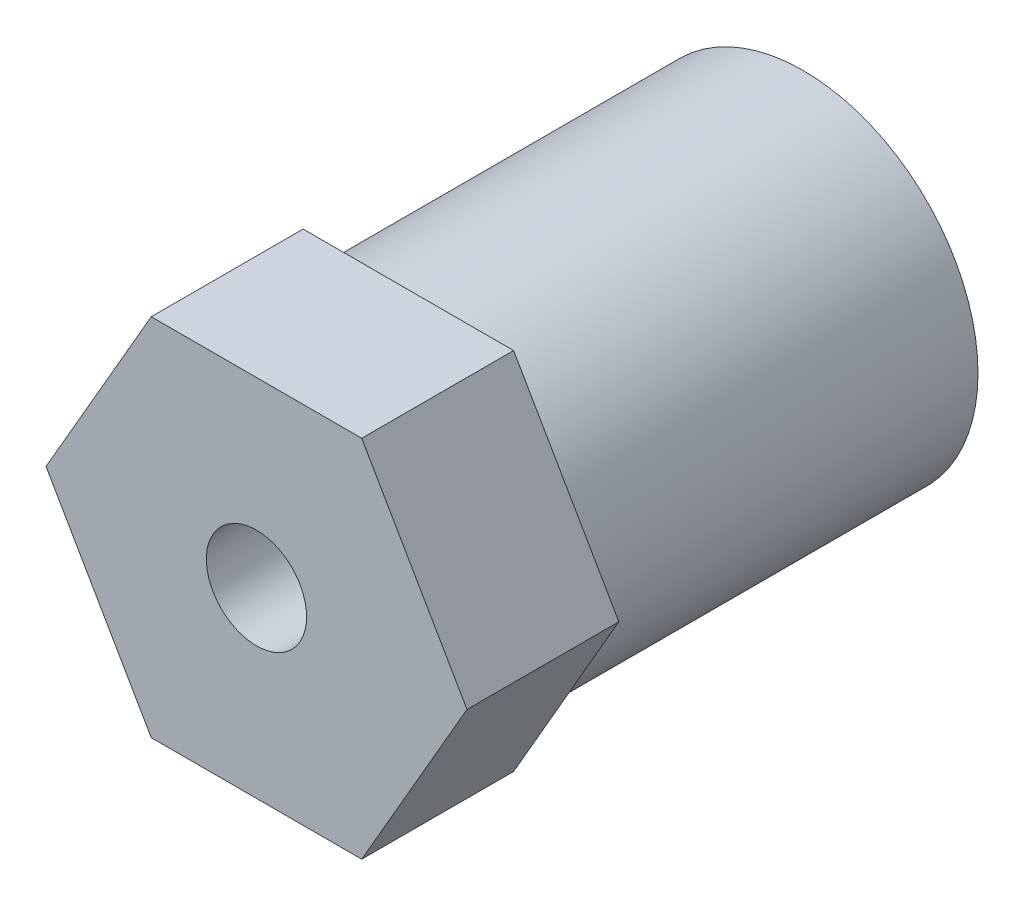
from build123d import *

# Parameters (mm, degrees)
TAP_DRILL_FOR_M4X0_7_TAP1_D     = 3.3
TAP_DRILL_FOR_M4X0_7_TAP1_DEPTH = 5
TAP_DRILL_FOR_M4X0_7_TAP1_TIP   = 0.991420021
SKETCH9_OUTSIDE_W               = 25.62
SKETCH9_OUTSIDE_H               = 25.62
CUT_EXTRUDE1_DEPTH              = 22.843191159


with BuildPart() as part:
    # Sketch1 → Revolve1 (revolve)
    with BuildSketch(Plane(origin=(0, 0, 0), x_dir=(0, 0, -1), z_dir=(1, 0, 0)), mode=Mode.PRIVATE) as revolve1_sk:
        Polygon((0, -2), (0, -5.75), (-13, -5.75), (-13, -8.75), (-18, -8.75), (-18, 0), (-13, 0), (-13, -2), align=None)
    revolve(revolve1_sk.sketch.rotate(Axis((0, 0, 36.965240676), (0, 0, -1)), 270), axis=Axis((0, 0, 36.965240676), (0, 0, -1)))

    # Tap Drill for M4x0.7 Tap1
    with Locations(Plane.XY.offset(18)):
        with Locations((0, 0)):
            Hole(TAP_DRILL_FOR_M4X0_7_TAP1_D / 2, depth=TAP_DRILL_FOR_M4X0_7_TAP1_DEPTH)
            with Locations((0, 0, -(TAP_DRILL_FOR_M4X0_7_TAP1_DEPTH + TAP_DRILL_FOR_M4X0_7_TAP1_TIP / 2))):  # 118° drill point
                Cone(0, TAP_DRILL_FOR_M4X0_7_TAP1_D / 2, TAP_DRILL_FOR_M4X0_7_TAP1_TIP, mode=Mode.SUBTRACT)

    # Sketch9 outside → Cut-Extrude1 (cut, through all)
    with BuildSketch(Plane.XY.offset(18)):
        Rectangle(SKETCH9_OUTSIDE_W, SKETCH9_OUTSIDE_H)
        Polygon((3.464101615, -6), (6.92820323, 0), (3.464101615, 6), (-3.464101615, 6), (-6.92820323, 0), (-3.464101615, -6), align=None, mode=Mode.SUBTRACT)
    extrude(amount=-CUT_EXTRUDE1_DEPTH, mode=Mode.SUBTRACT)


solid = part.part
